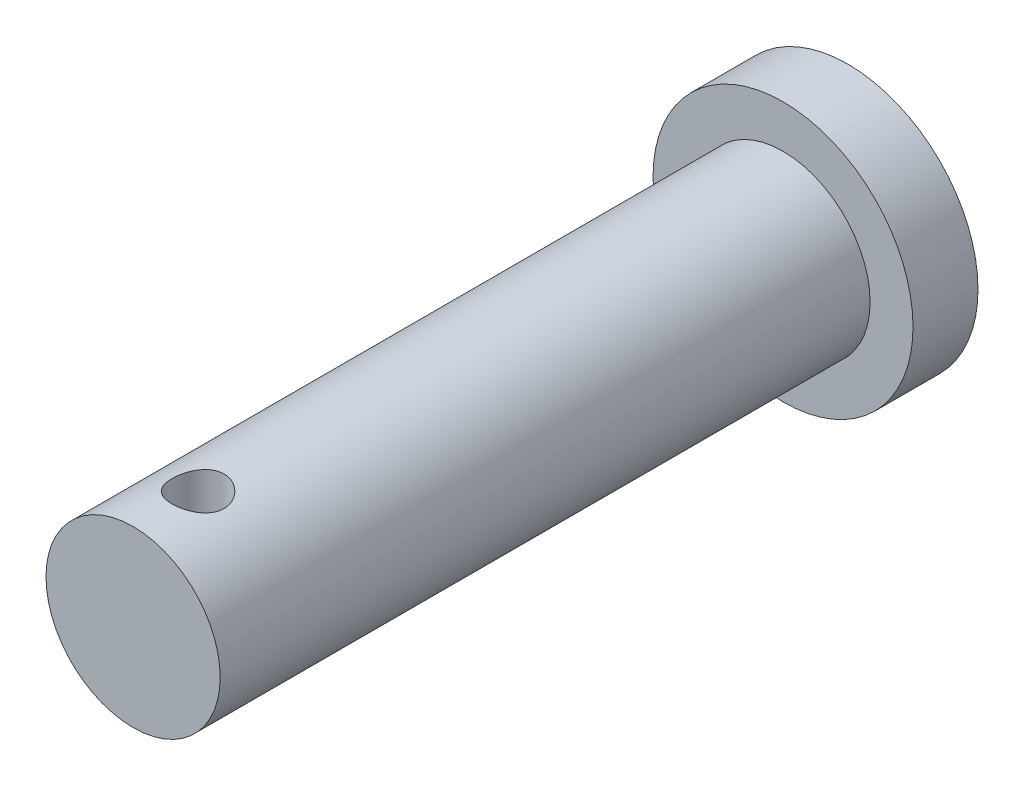
from build123d import *

# Parameters (mm, degrees)
SKETCH2_R               = 6.7
BOSS_EXTRUDE1_DEPTH     = 55
SKETCH3_R               = 10
BOSS_EXTRUDE2_DEPTH     = 5
CUT_EXTRUDE1_DEPTH      = 10
CUT_EXTRUDE1_DEPTH_BACK = 15
SKETCH5_R               = 2


with BuildPart() as part:
    # Sketch2 → Boss-Extrude1 (new body)
    with BuildSketch(Plane.XY):
        Circle(SKETCH2_R)
    extrude(amount=BOSS_EXTRUDE1_DEPTH)

    # Sketch3 → Boss-Extrude2 (add)
    with BuildSketch(Plane(origin=(0, 0, 0), x_dir=(-1, 0, 0), z_dir=(0, 0, -1))):
        Circle(SKETCH3_R)
    extrude(amount=-BOSS_EXTRUDE2_DEPTH)

    # Sketch5 → Cut-Extrude1 (cut, two sides: drawn at the far end of the back side and taken through both)
    with BuildSketch(Plane(origin=(0, 0, 0), x_dir=(1, 0, 0), z_dir=(0, 1, 0)).offset(-CUT_EXTRUDE1_DEPTH_BACK)):
        with Locations(Location((0, -50, 0), (0, 0, 90))):
            Circle(SKETCH5_R)
    extrude(amount=CUT_EXTRUDE1_DEPTH + CUT_EXTRUDE1_DEPTH_BACK, mode=Mode.SUBTRACT)


solid = part.part
